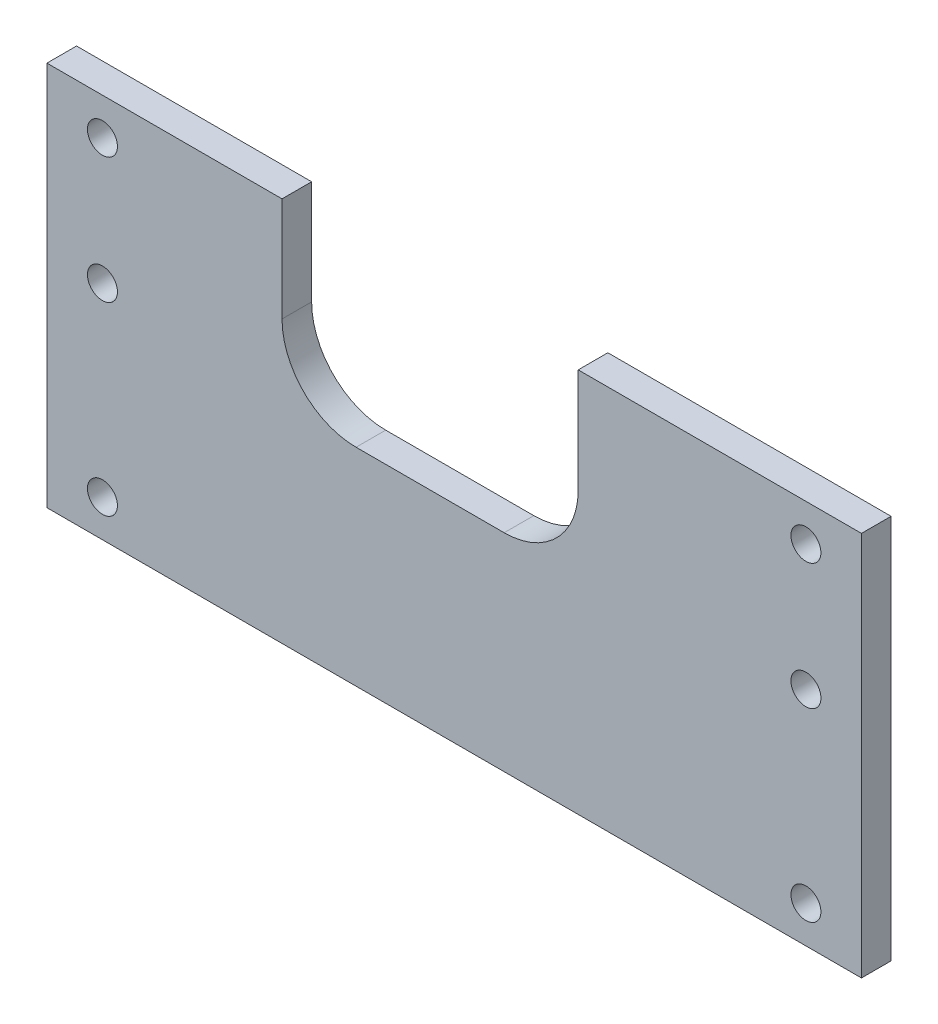
from build123d import *

# Parameters (mm, degrees)
SKETCH_1_W          = 110
SKETCH_1_H          = 52
EXTRUDE_1_DEPTH     = 4
SKETCH_2_R          = 2.025
CUT_EXTRUDE_1_DEPTH = 4
SKETCH_3_W          = 39.999993186
SKETCH_3_H          = 39
CUT_EXTRUDE_2_DEPTH = 4
FILLET_1_R          = 10


with BuildPart() as part:
    # 草图1 → 凸台-拉伸1 (new body)
    with BuildSketch(Plane.XY):
        Rectangle(SKETCH_1_W, SKETCH_1_H)
    extrude(amount=EXTRUDE_1_DEPTH)

    # 草图2 → 切除-拉伸1 (cut)
    with BuildSketch(Plane(origin=(0, 0, 0), x_dir=(-1, 0, 0), z_dir=(0, 0, -1))):
        with Locations((-47.5, 21)):
            Circle(SKETCH_2_R)
        with Locations((-47.5, 4)):
            Circle(SKETCH_2_R)
        with Locations((-47.5, -21)):
            Circle(SKETCH_2_R)
        with Locations(Location((47.5, -21, 0), (0, 0, 180))):
            Circle(SKETCH_2_R)
        with Locations(Location((47.5, 4, 0), (0, 0, 180))):
            Circle(SKETCH_2_R)
        with Locations(Location((47.5, 21, 0), (0, 0, 180))):
            Circle(SKETCH_2_R)
    extrude(amount=-CUT_EXTRUDE_1_DEPTH, mode=Mode.SUBTRACT)

    # 草图3 → 切除-拉伸2 (cut)
    with BuildSketch(Plane(origin=(0, 0, 0), x_dir=(-1, 0, 0), z_dir=(0, 0, -1))):
        with Locations((3.249996593, 21.45)):
            Rectangle(SKETCH_3_W, SKETCH_3_H)
    extrude(amount=-CUT_EXTRUDE_2_DEPTH, mode=Mode.SUBTRACT)

    # 圆角1
    fillet_1_edges = [part.edges().sort_by_distance(p)[0] for p in [
        (16.75, 1.95, 2),
        (-23.249993186, 1.95, 2),
    ]]
    fillet(fillet_1_edges, radius=FILLET_1_R)


solid = part.part
